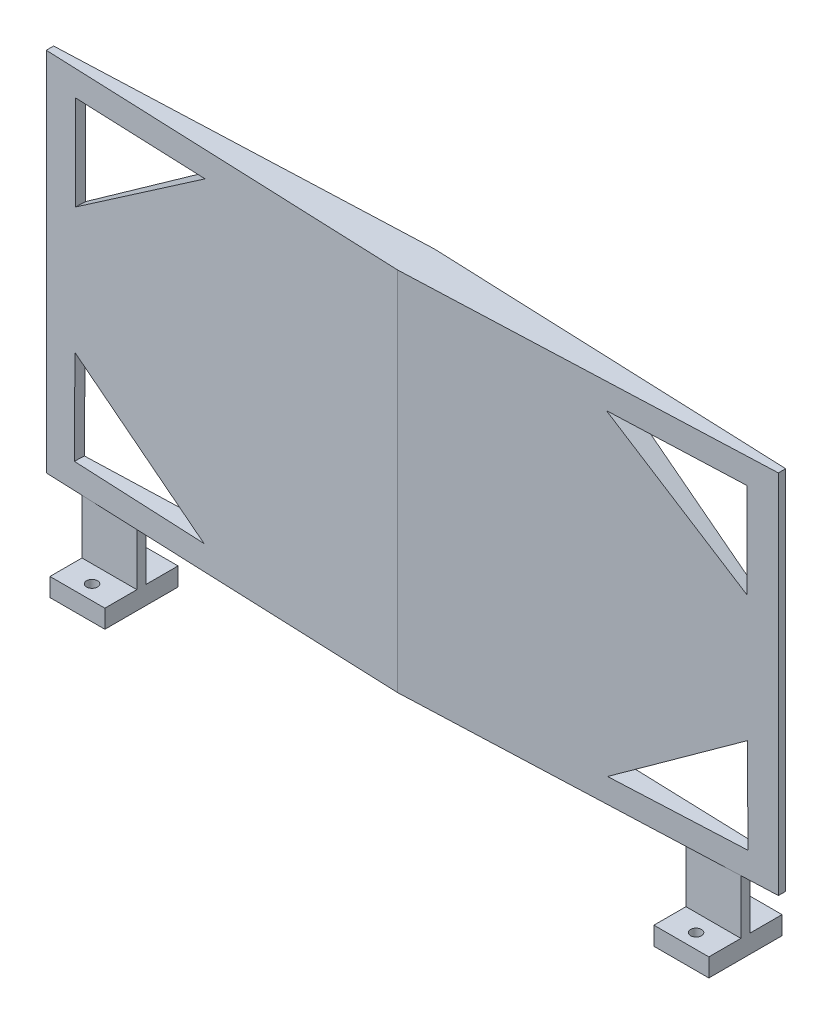
from build123d import *

# Parameters (mm, degrees)
BOSS_EXTRUDE4_DEPTH     = 100
SKETCH8_W               = 15
SKETCH8_H               = 2.5
BOSS_EXTRUDE5_DEPTH     = 15
SKETCH9_W               = 15
SKETCH9_H               = 20
BOSS_EXTRUDE6_DEPTH     = 5
CUT_EXTRUDE1_REACH      = 144.354
SKETCH11_R              = 1.5
CUT_EXTRUDE2_DEPTH      = 5
MIRROR4_COPY_1_SKETCH_R = 1.5
MIRROR4_COPY_1_DEPTH    = 5


with BuildPart() as part:
    # Sketch7 → Boss-Extrude4 (new body)
    with BuildSketch(Plane(origin=(0, 0, 0), x_dir=(1, 0, 0), z_dir=(0, 1, 0))):
        Polygon((100, -1), (100, 1), (0, 5), (-100, 1), (-100, -1), (0, -5), align=None)
    extrude(amount=BOSS_EXTRUDE4_DEPTH)

    # Sketch8 → Boss-Extrude5 (add)
    with BuildSketch(Plane.XZ):
        with Locations((-82.5, 0)):
            Rectangle(SKETCH8_W, SKETCH8_H)
    boss_extrude5 = extrude(amount=BOSS_EXTRUDE5_DEPTH)

    # Sketch9 → Boss-Extrude6 (add)
    with BuildSketch(Plane.XZ.offset(15)):
        with Locations((-82.5, 0)):
            Rectangle(SKETCH9_W, SKETCH9_H)
    boss_extrude6 = extrude(amount=BOSS_EXTRUDE6_DEPTH)

    # Mirror1: Boss-Extrude5, Boss-Extrude6 across plane
    add(boss_extrude5.mirror(Plane(origin=(0, 0, 0), x_dir=(0, 0, 1), z_dir=(1, 0, 0))))
    add(boss_extrude6.mirror(Plane(origin=(0, 0, 0), x_dir=(0, 0, 1), z_dir=(1, 0, 0))))

    # Cut-Extrude1: up to this plane
    cut_extrude1_end = Plane(origin=(-100, 100, -1), z_dir=(0.03996803834887159, 0, 0.9992009587217895))
    # Sketch10 → Cut-Extrude1 (cut, up to the surface)
    with BuildSketch(Plane(origin=(-0.199680511, 0, 4.99201278), x_dir=(0.9992009587217895, 0, 0.03996803834887158), z_dir=(-0.039968038348871575, 0, 0.9992009587217894)), mode=Mode.PRIVATE) as cut_extrude1_sk1:
        Polygon((-91.601994525, 67.204299414), (-91.601994525, 93.057612221), (-54.669790851, 93.057612221), align=None)
    cut_extrude1_tool1 = split(extrude(cut_extrude1_sk1.sketch, amount=-CUT_EXTRUDE1_REACH, mode=Mode.PRIVATE), bisect_by=cut_extrude1_end, keep=Keep.BOTH, mode=Mode.PRIVATE)
    # Sketch10 → Cut-Extrude1 (cut, up to the surface)
    with BuildSketch(Plane(origin=(-0.199680511, 0, 4.99201278), x_dir=(0.9992009587217895, 0, 0.03996803834887158), z_dir=(-0.039968038348871575, 0, 0.9992009587217894)), mode=Mode.PRIVATE) as cut_extrude1_sk2:
        Polygon((-91.895790601, 6.886941419), (-54.964445552, 6.635106072), (-91.719500606, 32.739653171), align=None)
    cut_extrude1_tool2 = split(extrude(cut_extrude1_sk2.sketch, amount=-CUT_EXTRUDE1_REACH, mode=Mode.PRIVATE), bisect_by=cut_extrude1_end, keep=Keep.BOTH, mode=Mode.PRIVATE)
    cut_extrude1 = cut_extrude1_tool1.solids().sort_by_distance((-79.427583, 84.439841, 1.822897))[0] + cut_extrude1_tool2.solids().sort_by_distance((-79.662714, 15.420567, 1.813491))[0]
    add(cut_extrude1, mode=Mode.SUBTRACT)

    # Mirror2: Cut-Extrude1 across plane
    add(cut_extrude1.mirror(Plane(origin=(0, 0, 0), x_dir=(0, 0, 1), z_dir=(1, 0, 0))), mode=Mode.SUBTRACT)

    # Sketch11 → Cut-Extrude2 (cut)
    with BuildSketch(Plane(origin=(0, -15, 0), x_dir=(1, 0, 0), z_dir=(0, 1, 0))):
        with Locations(Location((-82.5, 6, 0), (0, 0, 270))):
            Circle(SKETCH11_R)
    cut_extrude2 = extrude(amount=-CUT_EXTRUDE2_DEPTH, mode=Mode.SUBTRACT)

    # Mirror3: Cut-Extrude2 across plane
    add(cut_extrude2.mirror(Plane.XY), mode=Mode.SUBTRACT)

    # Mirror4: Cut-Extrude2 across plane
    add(cut_extrude2.mirror(Plane(origin=(0, 0, 0), x_dir=(0, 0, 1), z_dir=(1, 0, 0))), mode=Mode.SUBTRACT)

    # Mirror4 copy 1 sketch → Mirror4 copy 1 (cut)
    with BuildSketch(Plane(origin=(0, -15, 0), x_dir=(-1, 0, 0), z_dir=(0, 1, 0))):
        with Locations(Location((-82.5, 6, 0), (0, 0, 270))):
            Circle(MIRROR4_COPY_1_SKETCH_R)
    extrude(amount=-MIRROR4_COPY_1_DEPTH, mode=Mode.SUBTRACT)


solid = part.part
